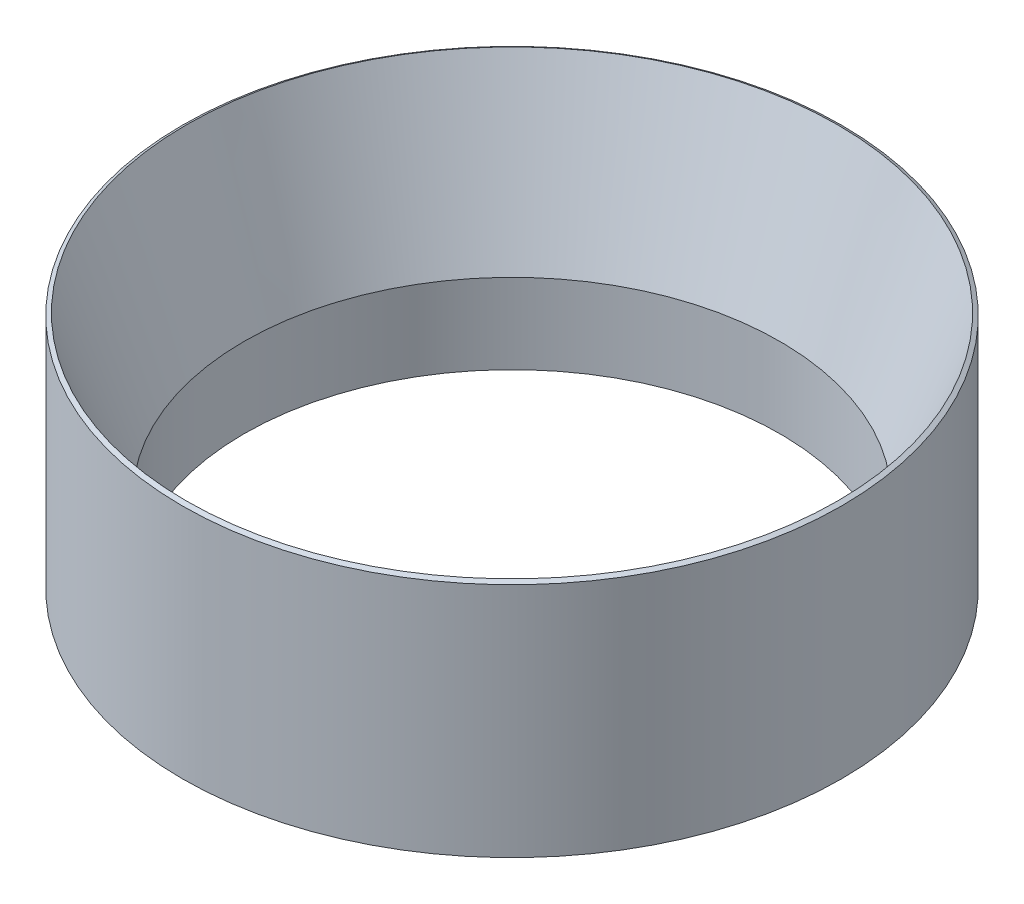
from build123d import *


with BuildPart() as part:
    # Sketch1 → Revolve1 (revolve)
    with BuildSketch(Plane.XY, mode=Mode.PRIVATE) as revolve1_sk:
        Polygon((42.545, 12.7), (51.7144, 37.89271945), (52.3494, 37.526102029), (52.3494, 0), (42.545, 0), align=None)
    revolve(revolve1_sk.sketch.rotate(Axis((0, 39.637367611, 0), (0, -1, 0)), 180), axis=Axis((0, 39.637367611, 0), (0, -1, 0)))


solid = part.part
